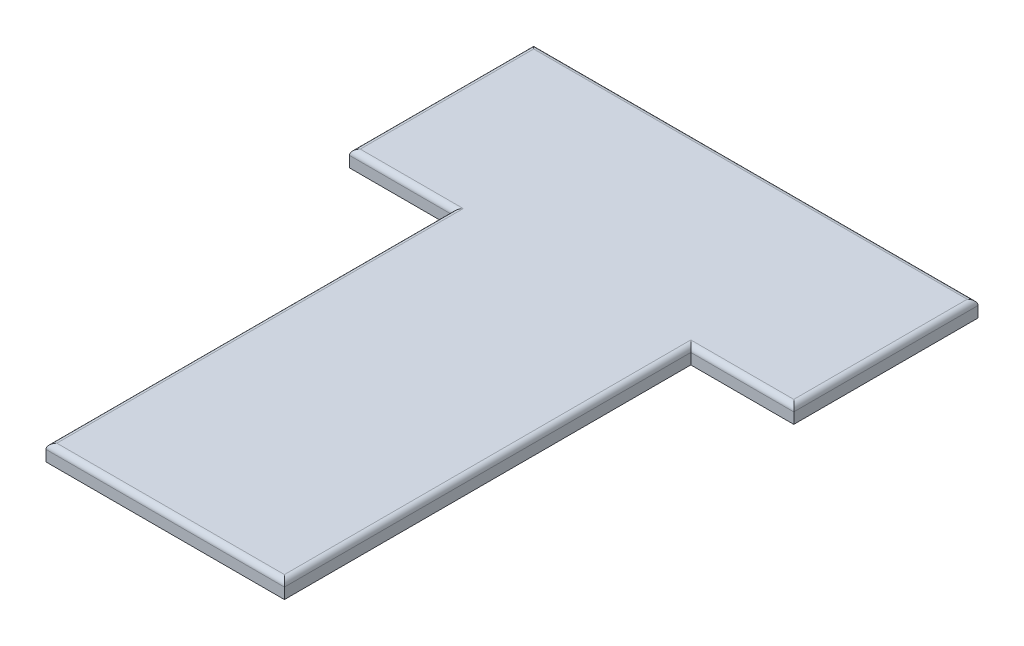
from build123d import *

# Parameters (mm, degrees)
BOSS_EXTRUDE1_DEPTH = 3
FILLET2_R           = 1


with BuildPart() as part:
    # Sketch1 → Boss-Extrude1 (new body)
    with BuildSketch(Plane(origin=(0, 0, 0), x_dir=(1, 0, 0), z_dir=(0, 1, 0))):
        Polygon((19, 0), (19, 75), (0, 75), (0, 109), (82, 109), (82, 75), (63, 75), (63, 0), align=None)
    extrude(amount=BOSS_EXTRUDE1_DEPTH)

    # Fillet2
    fillet2_edges = [part.edges().sort_by_distance(p)[0] for p in [
        (72.5, 3, -75),
        (82, 3, -92),
        (41, 3, -109),
        (0, 3, -92),
        (9.5, 3, -75),
        (19, 3, -37.5),
        (41, 3, 0),
        (63, 3, -37.5),
    ]]
    fillet(fillet2_edges, radius=FILLET2_R)


solid = part.part
